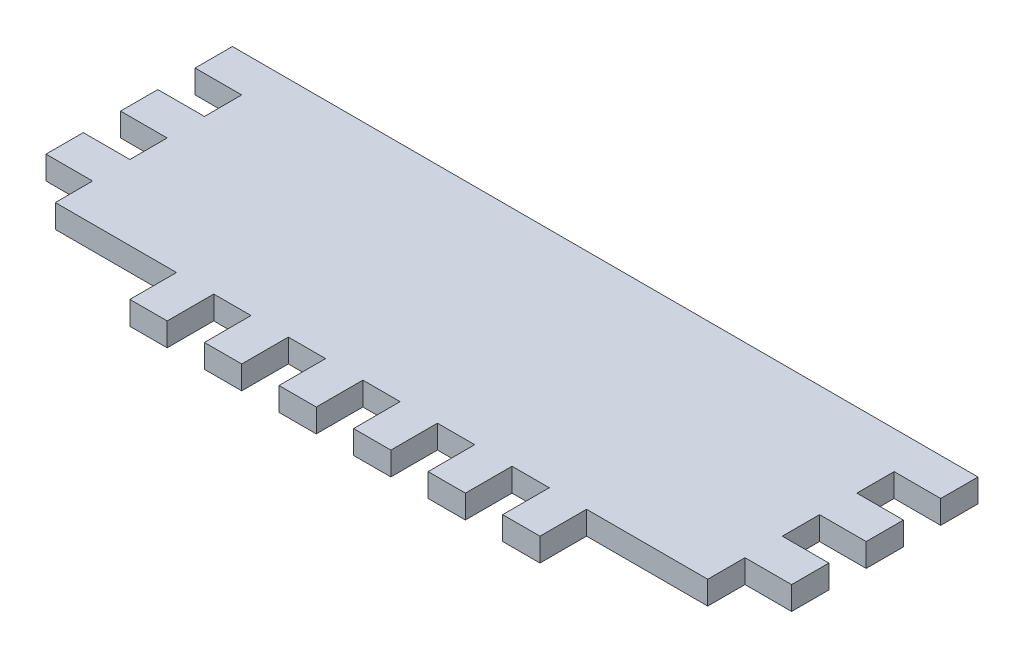
from build123d import *

# Parameters (mm, degrees)
SKETCH1_W           = 88.9
SKETCH1_H           = 30.48
BOSS_EXTRUDE1_DEPTH = 3.175
SKETCH3_W           = 5.08
SKETCH3_H           = 3.175
BOSS_EXTRUDE2_DEPTH = 3.175
SKETCH4_W           = 5.08
SKETCH4_H           = 3.175
BOSS_EXTRUDE3_DEPTH = 3.175
SKETCH5_W           = 6.35
SKETCH5_H           = 5.08
BOSS_EXTRUDE4_DEPTH = 3.175


with BuildPart() as part:
    # Sketch1 → Boss-Extrude1 (new body)
    with BuildSketch(Plane(origin=(0, 0, 0), x_dir=(1, 0, 0), z_dir=(0, 1, 0))):
        Rectangle(SKETCH1_W, SKETCH1_H)
    extrude(amount=BOSS_EXTRUDE1_DEPTH)

    # Sketch3 → Boss-Extrude2 (add)
    with BuildSketch(Plane(origin=(0, 0, 0), x_dir=(1, 0, 0), z_dir=(0, 1, 0))):
        with Locations((-25.4, -16.8275)):
            Rectangle(SKETCH3_W, SKETCH3_H)
        with Locations((-15.24, -16.8275)):
            Rectangle(SKETCH3_W, SKETCH3_H)
        with Locations((-5.08, -16.8275)):
            Rectangle(SKETCH3_W, SKETCH3_H)
        with Locations((5.08, -16.8275)):
            Rectangle(SKETCH3_W, SKETCH3_H)
        with Locations((15.24, -16.8275)):
            Rectangle(SKETCH3_W, SKETCH3_H)
        with Locations((25.4, -16.8275)):
            Rectangle(SKETCH3_W, SKETCH3_H)
    extrude(amount=BOSS_EXTRUDE2_DEPTH)

    # Sketch4 → Boss-Extrude3 (add)
    with BuildSketch(Plane(origin=(0, 3.175, 0), x_dir=(1, 0, 0), z_dir=(0, 1, 0))):
        with Locations((-25.4, -20.0025)):
            Rectangle(SKETCH4_W, SKETCH4_H)
        with Locations((-15.24, -20.0025)):
            Rectangle(SKETCH4_W, SKETCH4_H)
        with Locations((-5.08, -20.0025)):
            Rectangle(SKETCH4_W, SKETCH4_H)
        with Locations((5.08, -20.0025)):
            Rectangle(SKETCH4_W, SKETCH4_H)
        with Locations((15.24, -20.0025)):
            Rectangle(SKETCH4_W, SKETCH4_H)
        with Locations((25.4, -20.0025)):
            Rectangle(SKETCH4_W, SKETCH4_H)
    extrude(amount=-BOSS_EXTRUDE3_DEPTH)

    # Sketch5 → Boss-Extrude4 (add)
    with BuildSketch(Plane(origin=(0, 3.175, 0), x_dir=(1, 0, 0), z_dir=(0, 1, 0))):
        with Locations((-47.625, 2.54)):
            Rectangle(SKETCH5_W, SKETCH5_H)
        with Locations((-47.625, 12.7)):
            Rectangle(SKETCH5_W, SKETCH5_H)
        with Locations((-47.625, -7.62)):
            Rectangle(SKETCH5_W, SKETCH5_H)
        with Locations((47.625, -7.62)):
            Rectangle(SKETCH5_W, SKETCH5_H)
        with Locations((47.625, 2.54)):
            Rectangle(SKETCH5_W, SKETCH5_H)
        with Locations((47.625, 12.7)):
            Rectangle(SKETCH5_W, SKETCH5_H)
    extrude(amount=-BOSS_EXTRUDE4_DEPTH)


solid = part.part
